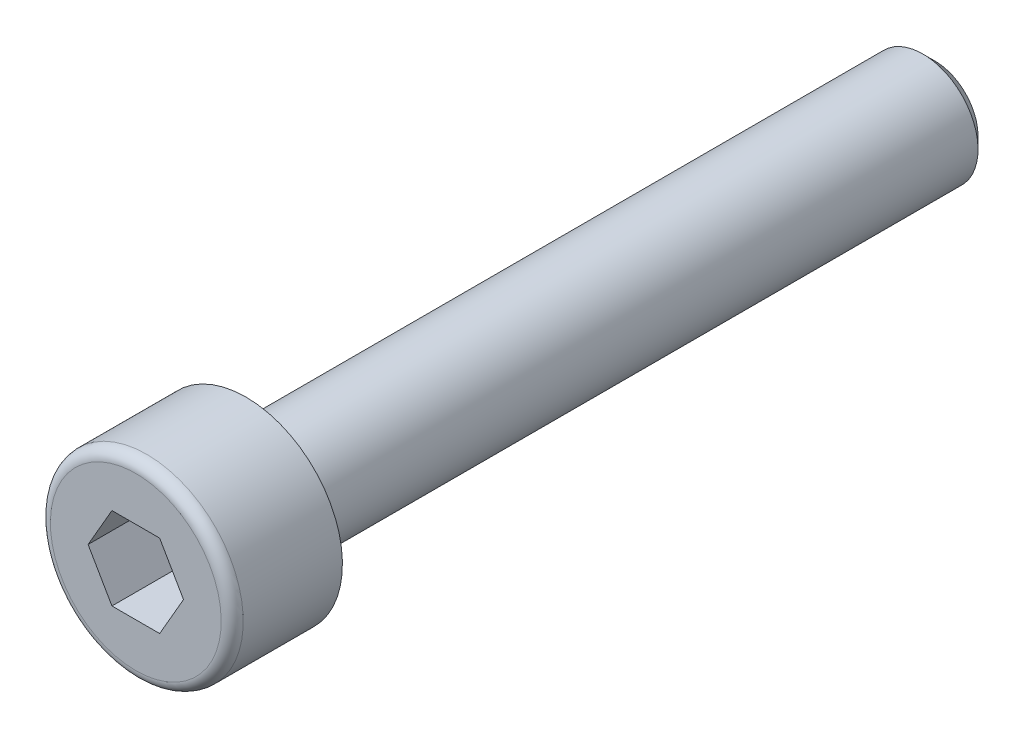
from build123d import *

# Parameters (mm, degrees)
ESQUISSE1_R             = 0.04
ENL_V_MAT_EXTRU_1_DEPTH = 2.993042463
ESQUISSE3_R             = 2
BOSS_EXTRU_1_DEPTH      = 24.8
CHANFREIN1_SIZE         = 0.4294
CONG_1_R                = 0.4


with BuildPart() as part:
    # Esquisse1 → Révolution1 (revolve)
    with BuildSketch(Plane.XZ, mode=Mode.PRIVATE) as r_volution1_sk:
        with BuildLine():
            Line((3.5, 4), (0, 4))
            Line((0, 4), (0, -0.2))
            Line((0, -0.2), (2, -0.2))
            ThreePointArc((2, -0.2), (2.058578644, -0.058578644), (2.2, 0))
            Line((2.2, 0), (3.5, 0))
            Line((3.5, 0), (3.5, 4))
        make_face()
        with Locations((2, 0)):
            Circle(ESQUISSE1_R, mode=Mode.SUBTRACT)
    revolve(r_volution1_sk.sketch.rotate(Axis((0, 0, 4), (0, 0, -1)), 270), axis=Axis((0, 0, 4), (0, 0, -1)))

    # Esquisse2 → Enlèv. mat.-Extru.1 (cut)
    with BuildSketch(Plane.XY.offset(4)):
        Polygon((1.732050808, 0), (0.866025404, 1.5), (-0.866025404, 1.5), (-1.732050808, 0), (-0.866025404, -1.5), (0.866025404, -1.5), align=None)
    extrude(amount=-ENL_V_MAT_EXTRU_1_DEPTH, mode=Mode.SUBTRACT)

    # Esquisse3 → Boss.-Extru.1 (add)
    with BuildSketch(Plane(origin=(0, 0, -0.2), x_dir=(-1, 0, 0), z_dir=(0, 0, -1))):
        with Locations(Location((0, 0, 0), (0, 0, 270))):
            Circle(ESQUISSE3_R)
    extrude(amount=BOSS_EXTRU_1_DEPTH)

    # Chanfrein1
    chanfrein1_edges = [part.edges().sort_by_distance(p)[0] for p in [
        (0, 2, -25),
    ]]
    chamfer(chanfrein1_edges, length=CHANFREIN1_SIZE)

    # Congé1
    cong_1_edges = [part.edges().sort_by_distance(p)[0] for p in [
        (0, -3.5, 4),
    ]]
    fillet(cong_1_edges, radius=CONG_1_R)


solid = part.part
